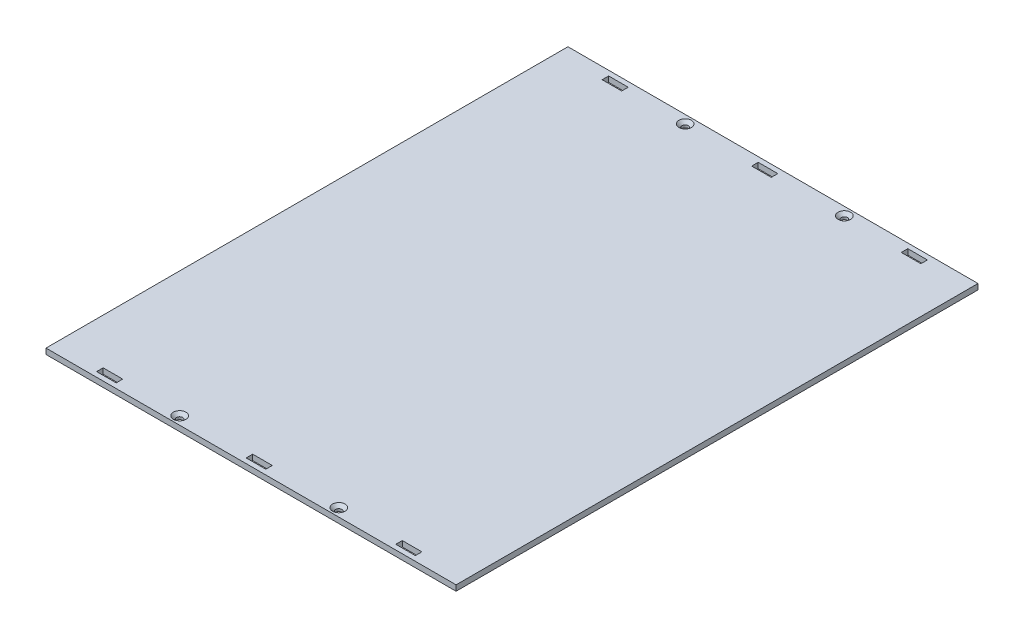
from build123d import *

# Parameters (mm, degrees)
CROQUIS1_W                                   = 220
CROQUIS1_H                                   = 280
CROQUIS1_R                                   = 1
CROQUIS1_W_2                                 = 10.5
CROQUIS1_H_2                                 = 3.5
SALIENTE_EXTRUIR1_DEPTH                      = 3
REFRENTADO_PARA_TORNILLO_TAP_N_CON_C_2_COUNT = 2
REFRENTADO_PARA_TORNILLO_TAP_N_CON_C_2_PITCH = 85.4
REFRENTADO_PARA_TORNILLO_TAP_N_CON_C_3_COUNT = 2
REFRENTADO_PARA_TORNILLO_TAP_N_CON_C_3_PITCH = 271.2
REFRENTADO_PARA_TORNILLO_TAP_N_CON_C_4_COUNT = 2
REFRENTADO_PARA_TORNILLO_TAP_N_CON_C_4_PITCH = 284.328331335


with BuildPart() as part:
    # Croquis1 → Saliente-Extruir1 (new body)
    with BuildSketch(Plane(origin=(0, 0, 0), x_dir=(1, 0, 0), z_dir=(0, 1, 0))):
        Rectangle(CROQUIS1_W, CROQUIS1_H)
        with Locations(Location((-42.7, -135.6, 0), (0, 0, 270))):
            Circle(CROQUIS1_R, mode=Mode.SUBTRACT)
        with Locations(Location((42.7, -135.6, 0), (0, 0, 90))):
            Circle(CROQUIS1_R, mode=Mode.SUBTRACT)
        with Locations(Location((42.7, 135.6, 0), (0, 0, 270))):
            Circle(CROQUIS1_R, mode=Mode.SUBTRACT)
        with Locations(Location((-42.7, 135.6, 0), (0, 0, 90))):
            Circle(CROQUIS1_R, mode=Mode.SUBTRACT)
        with Locations((-80.25, -135.6)):
            Rectangle(CROQUIS1_W_2, CROQUIS1_H_2, mode=Mode.SUBTRACT)
        with Locations((0, -135.6)):
            Rectangle(CROQUIS1_W_2, CROQUIS1_H_2, mode=Mode.SUBTRACT)
        with Locations((80.25, -135.6)):
            Rectangle(CROQUIS1_W_2, CROQUIS1_H_2, mode=Mode.SUBTRACT)
        with Locations((0, 135.6)):
            Rectangle(CROQUIS1_W_2, CROQUIS1_H_2, mode=Mode.SUBTRACT)
        with Locations((80.25, 135.6)):
            Rectangle(CROQUIS1_W_2, CROQUIS1_H_2, mode=Mode.SUBTRACT)
        with Locations((-80.25, 135.6)):
            Rectangle(CROQUIS1_W_2, CROQUIS1_H_2, mode=Mode.SUBTRACT)
    extrude(amount=SALIENTE_EXTRUIR1_DEPTH)

    # Croquis2 → Refrentado para tornillo tapón con cabeza plana de clavija de M31 (revolve, cut)
    with BuildSketch(Plane(origin=(-42.7, 3, 135.6), x_dir=(0, 0, 1), z_dir=(1, 0, 0))):
        Polygon((0, 0), (0, 3), (1.7, 3), (1.7, 1.66), (3.36, 0), align=None)
    refrentado_para_tornillo_tap_n_con_cabez = revolve(axis=Axis((-42.7, 9.35, 135.6), (0, -1, 0)), mode=Mode.SUBTRACT)

    # Refrentado para tornillo tap_n con c 2: Refrentado para tornillo tapón con cabeza plana de clavija de M31 ×2
    with Locations(*[(i * REFRENTADO_PARA_TORNILLO_TAP_N_CON_C_2_PITCH, 0, 0) for i in range(1, REFRENTADO_PARA_TORNILLO_TAP_N_CON_C_2_COUNT)]):
        add(refrentado_para_tornillo_tap_n_con_cabez, mode=Mode.SUBTRACT)

    # Refrentado para tornillo tap_n con c 3: Refrentado para tornillo tapón con cabeza plana de clavija de M31 ×2
    with Locations(*[(0, 0, -i * REFRENTADO_PARA_TORNILLO_TAP_N_CON_C_3_PITCH) for i in range(1, REFRENTADO_PARA_TORNILLO_TAP_N_CON_C_3_COUNT)]):
        add(refrentado_para_tornillo_tap_n_con_cabez, mode=Mode.SUBTRACT)

    # Refrentado para tornillo tap_n con c 4: Refrentado para tornillo tapón con cabeza plana de clavija de M31 ×2
    with Locations(*[Vector(0.3003569837690427, 0, -0.9538268618052037) * (i * REFRENTADO_PARA_TORNILLO_TAP_N_CON_C_4_PITCH) for i in range(1, REFRENTADO_PARA_TORNILLO_TAP_N_CON_C_4_COUNT)]):
        add(refrentado_para_tornillo_tap_n_con_cabez, mode=Mode.SUBTRACT)


solid = part.part
